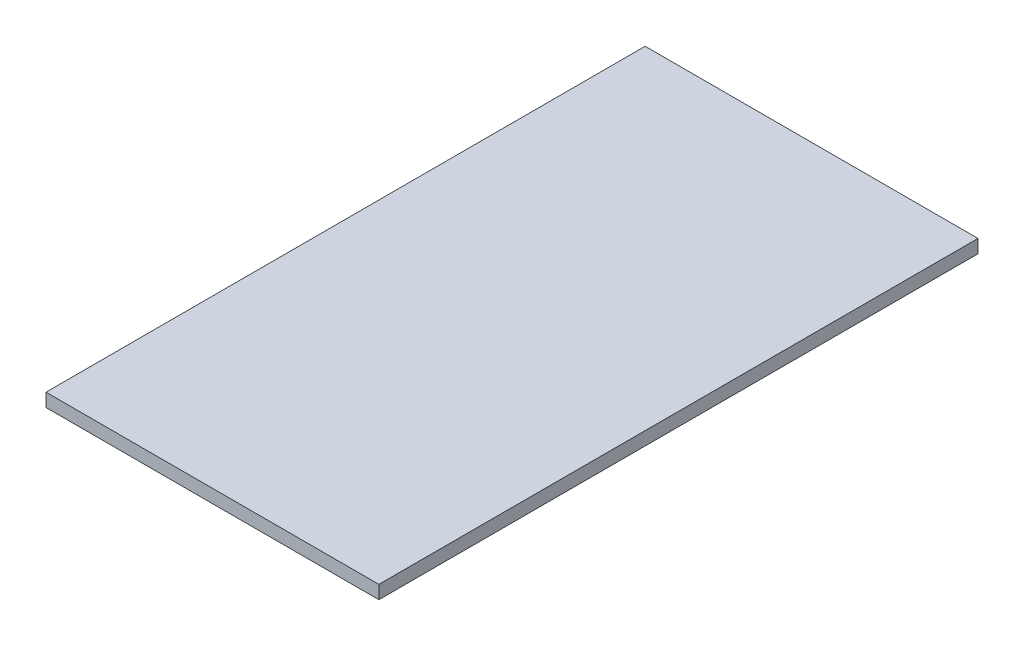
from build123d import *

# Parameters (mm, degrees)
SKETCH1_W           = 50
SKETCH1_H           = 90
BOSS_EXTRUDE1_DEPTH = 2


with BuildPart() as part:
    # Sketch1 → Boss-Extrude1 (new body)
    with BuildSketch(Plane(origin=(0, 0, 0), x_dir=(1, 0, 0), z_dir=(0, 1, 0))):
        Rectangle(SKETCH1_W, SKETCH1_H)
    extrude(amount=BOSS_EXTRUDE1_DEPTH)


solid = part.part
